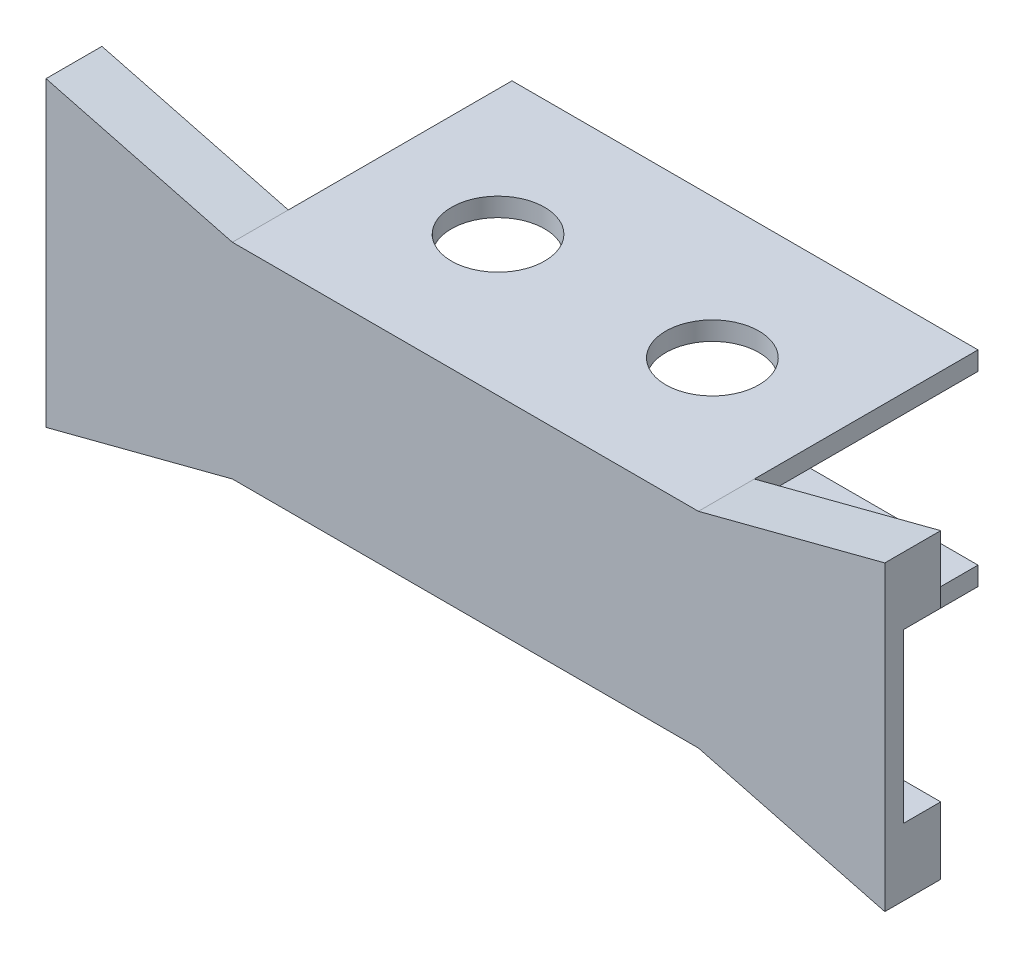
from build123d import *

# Parameters (mm, degrees)
SKETCH1_W           = 50
SKETCH1_H           = 30
SKETCH1_R           = 5
BOSS_EXTRUDE2_DEPTH = 2
BOSS_EXTRUDE3_DEPTH = 2
BOSS_EXTRUDE4_DEPTH = 6


with BuildPart() as part:
    # Sketch1 → Boss-Extrude2 (new body)
    with BuildSketch(Plane(origin=(0, 0, 0), x_dir=(1, 0, 0), z_dir=(0, 1, 0))):
        with Locations((-18.81443299, 0.927835052)):
            Rectangle(SKETCH1_W, SKETCH1_H)
        with Locations((-7.31443299, 0.927835052)):
            Circle(SKETCH1_R, mode=Mode.SUBTRACT)
        with Locations((-30.31443299, 0.927835052)):
            Circle(SKETCH1_R, mode=Mode.SUBTRACT)
    extrude(amount=BOSS_EXTRUDE2_DEPTH)

    # Sketch2 → Boss-Extrude3 (add)
    with BuildSketch(Plane.XY.offset(14.072164948)):
        Polygon((6.18556701, 0), (-43.81443299, 0), (-63.81443299, 0), (-63.81443299, -9), (26.18556701, -9), (26.18556701, 0), align=None)
    extrude(amount=-BOSS_EXTRUDE3_DEPTH)

    # Sketch2<4> → Boss-Extrude4 (add)
    with BuildSketch(Plane.XY.offset(14.072164948)):
        Polygon((-63.81443299, 0), (-43.81443299, 0), (-43.81443299, 2), (-63.81443299, 7.203034525), align=None)
        Polygon((6.18556701, 2), (6.18556701, 0), (26.18556701, 0), (26.18556701, 7.203034525), align=None)
    extrude(amount=-BOSS_EXTRUDE4_DEPTH)

    # Mirror1: part across plane


with BuildPart() as part_1:
    add(part.part)
    add(part.part.mirror(Plane(origin=(0, -9, 12.072164948), x_dir=(0, 0, 1), z_dir=(0, -1, 0))))


solid = part_1.part
